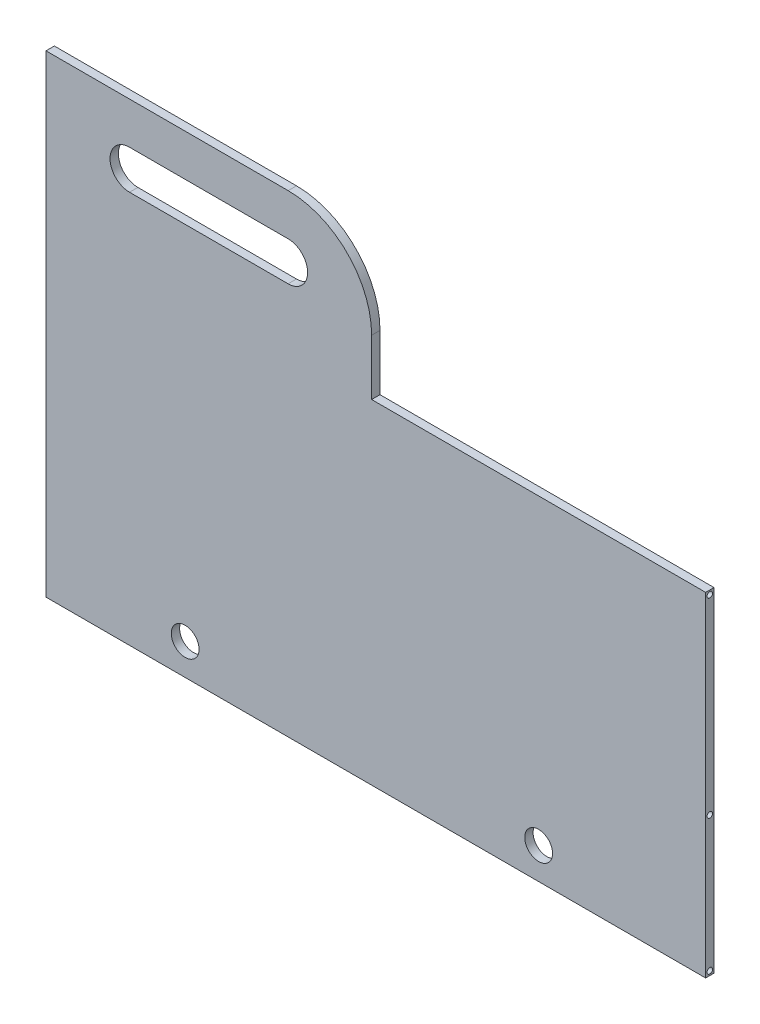
from build123d import *

# Parameters (mm, degrees)
SKETCH2_R           = 5
BOSS_EXTRUDE1_DEPTH = 3
SKETCH3_R           = 1
CUT_EXTRUDE1_DEPTH  = 10
SKETCH5_R           = 1
CUT_EXTRUDE2_DEPTH  = 10
CUT_EXTRUDE3_START  = -10
SKETCH6_R           = 1
CUT_EXTRUDE3_DEPTH  = 10


with BuildPart() as part:
    # Sketch2 → Boss-Extrude1 (new body)
    with BuildSketch(Plane.XY):
        with BuildLine():
            Line((117, 140), (117, 120))
            Line((117, 120), (237, 120))
            Line((237, 120), (237, 0))
            Line((237, 0), (0, 0))
            Line((0, 0), (0, 170))
            Line((0, 170), (87, 170))
            ThreePointArc((87, 170), (108.213203436, 161.213203436), (117, 140))
        make_face()
        with Locations((50, 11.25)):
            Circle(SKETCH2_R, mode=Mode.SUBTRACT)
        with Locations((177, 11.25)):
            Circle(SKETCH2_R, mode=Mode.SUBTRACT)
        with BuildLine():
            Line((30, 155), (87, 155))
            ThreePointArc((87, 155), (94, 148), (87, 141))
            Line((87, 141), (30, 141))
            ThreePointArc((30, 141), (23, 148), (30, 155))
        make_face(mode=Mode.SUBTRACT)
    extrude(amount=BOSS_EXTRUDE1_DEPTH)

    # Sketch3 → Cut-Extrude1 (cut)
    with BuildSketch(Plane.ZY):
        with Locations((1.5, 168.5)):
            Circle(SKETCH3_R)
        with Locations((1.5, 1.5)):
            Circle(SKETCH3_R)
    extrude(amount=-CUT_EXTRUDE1_DEPTH, mode=Mode.SUBTRACT)

    # Sketch5 → Cut-Extrude2 (cut)
    with BuildSketch(Plane.ZY):
        with Locations((1.5, 50)):
            Circle(SKETCH5_R)
    extrude(amount=-CUT_EXTRUDE2_DEPTH, mode=Mode.SUBTRACT)

    # Sketch6 → Cut-Extrude3 (cut)
    with BuildSketch(Plane(origin=(237, 0, 0), x_dir=(0, 0, -1), z_dir=(1, 0, 0)).offset(CUT_EXTRUDE3_START)):
        with Locations((-1.5, 118.5)):
            Circle(SKETCH6_R)
        with Locations((-1.5, 1.5)):
            Circle(SKETCH6_R)
        with Locations((-1.5, 50)):
            Circle(SKETCH6_R)
    extrude(amount=CUT_EXTRUDE3_DEPTH, mode=Mode.SUBTRACT)


solid = part.part
